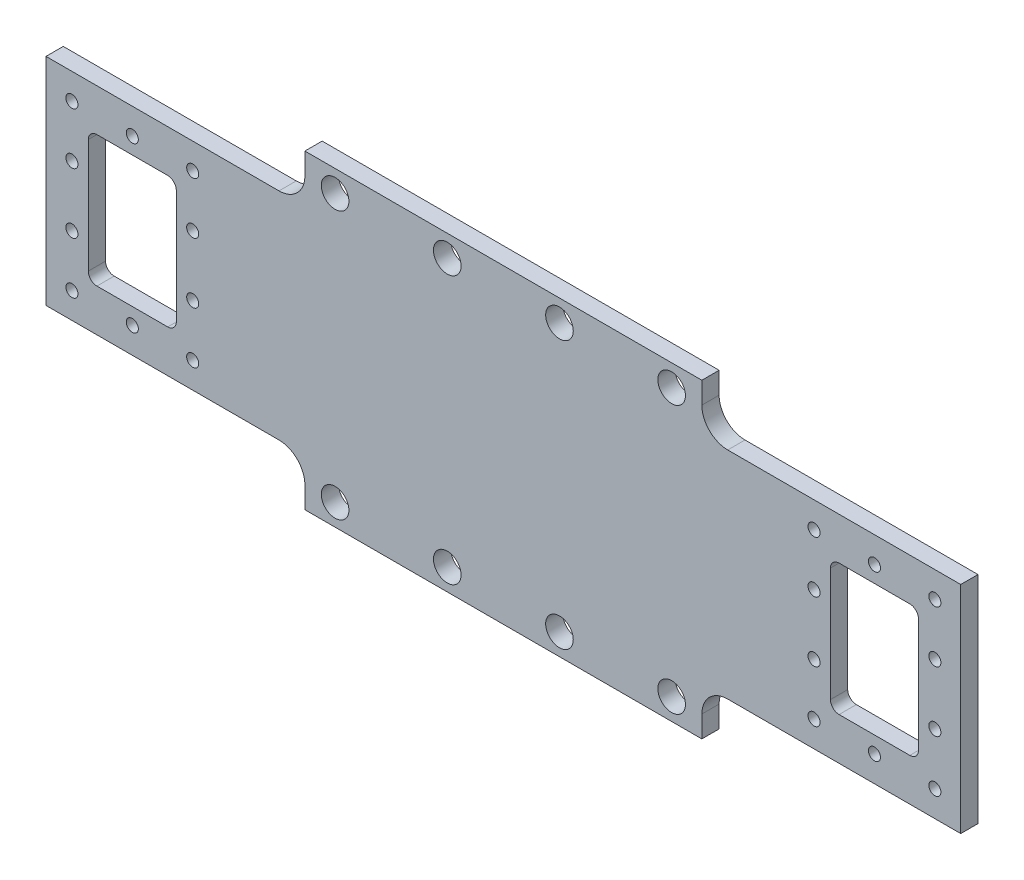
from build123d import *

# Parameters (mm, degrees)
SKETCH_1_W          = 1060
SKETCH_1_H          = 360
EXTRUDE_1_DEPTH     = 20
CUT_EXTRUDE_1_REACH = 562.089
SKETCH_3_R          = 16
SKETCH_3_R_2        = 7
CUT_EXTRUDE_2_DEPTH = 20


with BuildPart() as part:
    # 草图1 → 凸台-拉伸1 (new body)
    with BuildSketch(Plane.XY):
        Rectangle(SKETCH_1_W, SKETCH_1_H)
    extrude(amount=-EXTRUDE_1_DEPTH)

    # 草图2 → 切除-拉伸1 (cut, up to next)
    with BuildSketch(Plane.XY, mode=Mode.PRIVATE) as cut_extrude_1_sk1:
        with BuildLine():
            Line((-530, 180), (-230, 180))
            Line((-230, 180), (-230, 155))
            ThreePointArc((-230, 155), (-238.786796564, 133.786796564), (-260, 125))
            Line((-260, 125), (-530, 125))
            Line((-530, 125), (-530, 180))
        make_face()
    cut_extrude_1_tool1 = extrude(cut_extrude_1_sk1.sketch, amount=-CUT_EXTRUDE_1_REACH, mode=Mode.PRIVATE) & part.part
    # 草图2 → 切除-拉伸1 (cut, up to next)
    with BuildSketch(Plane.XY, mode=Mode.PRIVATE) as cut_extrude_1_sk2:
        with BuildLine():
            Line((230, 180), (230, 155))
            ThreePointArc((230, 155), (238.786796564, 133.786796564), (260, 125))
            Line((260, 125), (530, 125))
            Line((530, 125), (530, 180))
            Line((530, 180), (230, 180))
        make_face()
    cut_extrude_1_tool2 = extrude(cut_extrude_1_sk2.sketch, amount=-CUT_EXTRUDE_1_REACH, mode=Mode.PRIVATE) & part.part
    # 草图2 → 切除-拉伸1 (cut, up to next)
    with BuildSketch(Plane.XY, mode=Mode.PRIVATE) as cut_extrude_1_sk3:
        with BuildLine():
            Line((530, -180), (230, -180))
            Line((230, -180), (230, -155))
            ThreePointArc((230, -155), (238.786796564, -133.786796564), (260, -125))
            Line((260, -125), (530, -125))
            Line((530, -125), (530, -180))
        make_face()
    cut_extrude_1_tool3 = extrude(cut_extrude_1_sk3.sketch, amount=-CUT_EXTRUDE_1_REACH, mode=Mode.PRIVATE) & part.part
    # 草图2 → 切除-拉伸1 (cut, up to next)
    with BuildSketch(Plane.XY, mode=Mode.PRIVATE) as cut_extrude_1_sk4:
        with BuildLine():
            Line((-230, -180), (-230, -155))
            ThreePointArc((-230, -155), (-238.786796564, -133.786796564), (-260, -125))
            Line((-260, -125), (-530, -125))
            Line((-530, -125), (-530, -180))
            Line((-530, -180), (-230, -180))
        make_face()
    cut_extrude_1_tool4 = extrude(cut_extrude_1_sk4.sketch, amount=-CUT_EXTRUDE_1_REACH, mode=Mode.PRIVATE) & part.part
    add(cut_extrude_1_tool1.solids().sort_by_distance((-381.697261, 152.746347, 0))[0], mode=Mode.SUBTRACT)
    add(cut_extrude_1_tool2.solids().sort_by_distance((381.697261, 152.746347, 0))[0], mode=Mode.SUBTRACT)
    add(cut_extrude_1_tool3.solids().sort_by_distance((381.697261, -152.746347, 0))[0], mode=Mode.SUBTRACT)
    add(cut_extrude_1_tool4.solids().sort_by_distance((-381.697261, -152.746347, 0))[0], mode=Mode.SUBTRACT)

    # 草图3 → 切除-拉伸2 (cut)
    with BuildSketch(Plane.XY):
        with Locations((-195, 155)):
            Circle(SKETCH_3_R)
        with Locations((-65, 155)):
            Circle(SKETCH_3_R)
        with Locations((65, 155)):
            Circle(SKETCH_3_R)
        with Locations((195, 155)):
            Circle(SKETCH_3_R)
        with Locations((195, -155)):
            Circle(SKETCH_3_R)
        with Locations((65, -155)):
            Circle(SKETCH_3_R)
        with Locations((-65, -155)):
            Circle(SKETCH_3_R)
        with Locations((-195, -155)):
            Circle(SKETCH_3_R)
        with Locations((-500, 95)):
            Circle(SKETCH_3_R_2)
        with Locations((-430, 95)):
            Circle(SKETCH_3_R_2)
        with Locations((-360, 95)):
            Circle(SKETCH_3_R_2)
        with Locations((-500, 35)):
            Circle(SKETCH_3_R_2)
        with Locations((-500, -35)):
            Circle(SKETCH_3_R_2)
        with Locations((-500, -95)):
            Circle(SKETCH_3_R_2)
        with Locations((-360, 35)):
            Circle(SKETCH_3_R_2)
        with Locations((-360, -35)):
            Circle(SKETCH_3_R_2)
        with Locations((-360, -95)):
            Circle(SKETCH_3_R_2)
        with Locations((-430, -95)):
            Circle(SKETCH_3_R_2)
        with Locations((430, -95)):
            Circle(SKETCH_3_R_2)
        with Locations((360, -95)):
            Circle(SKETCH_3_R_2)
        with Locations((360, -35)):
            Circle(SKETCH_3_R_2)
        with Locations((360, 35)):
            Circle(SKETCH_3_R_2)
        with Locations((500, -95)):
            Circle(SKETCH_3_R_2)
        with Locations((500, -35)):
            Circle(SKETCH_3_R_2)
        with Locations((500, 35)):
            Circle(SKETCH_3_R_2)
        with Locations((360, 95)):
            Circle(SKETCH_3_R_2)
        with Locations((430, 95)):
            Circle(SKETCH_3_R_2)
        with Locations((500, 95)):
            Circle(SKETCH_3_R_2)
        with BuildLine():
            Line((-471, 76), (-389, 76))
            ThreePointArc((-389, 76), (-381.928932188, 73.071067812), (-379, 66))
            Line((-379, 66), (-379, -66))
            ThreePointArc((-379, -66), (-381.928932188, -73.071067812), (-389, -76))
            Line((-389, -76), (-471, -76))
            ThreePointArc((-471, -76), (-478.071067812, -73.071067812), (-481, -66))
            Line((-481, -66), (-481, 66))
            ThreePointArc((-481, 66), (-478.071067812, 73.071067812), (-471, 76))
        make_face()
        with BuildLine():
            Line((379, 66), (379, -66))
            ThreePointArc((379, -66), (381.928932188, -73.071067812), (389, -76))
            Line((389, -76), (471, -76))
            ThreePointArc((471, -76), (478.071067812, -73.071067812), (481, -66))
            Line((481, -66), (481, 66))
            ThreePointArc((481, 66), (478.071067812, 73.071067812), (471, 76))
            Line((471, 76), (389, 76))
            ThreePointArc((389, 76), (381.928932188, 73.071067812), (379, 66))
        make_face()
    extrude(amount=-CUT_EXTRUDE_2_DEPTH, mode=Mode.SUBTRACT)


solid = part.part
